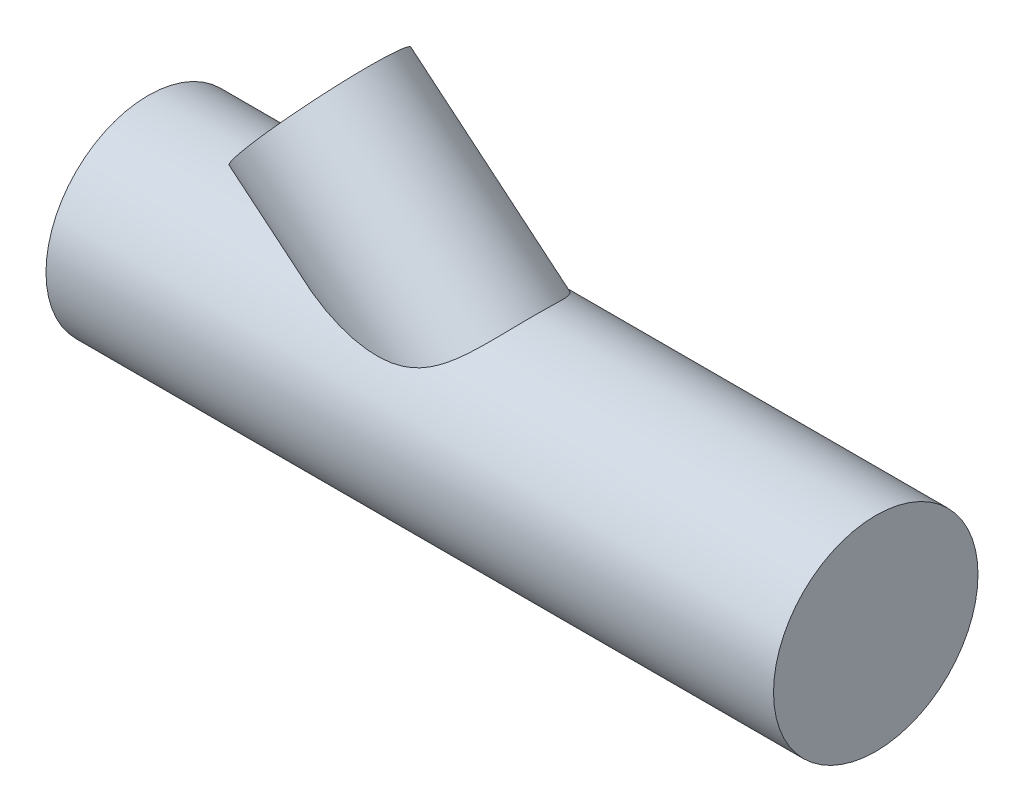
from build123d import *

# Parameters (mm, degrees)
SKETCH_2_W = 142.316235182
SKETCH_2_H = 20


with BuildPart() as part:
    # 草图2 → 旋转-薄壁1 (revolve)
    with BuildSketch(Plane(origin=(34.854392764, -17.173042845, 0), x_dir=(1, 0, 0), z_dir=(0, 0, 1)), mode=Mode.PRIVATE) as revolve_1_sk:
        with Locations((-33.020284957, 38.403293252)):
            Rectangle(SKETCH_2_W, SKETCH_2_H)
    revolve(revolve_1_sk.sketch.rotate(Axis((-69.324009784, 11.230250407, 0), (1, 0, 0)), 90), axis=Axis((-69.324009784, 11.230250407, 0), (1, 0, 0)))

    # 草图3 → 旋转-薄壁2 (revolve)
    with BuildSketch(Plane(origin=(10.637092158, -26.300007698, 0), x_dir=(1, 0, 0), z_dir=(0, 0, 1)), mode=Mode.PRIVATE) as revolve_2_sk:
        Polygon((-46.384190984, 72.518958842), (1.156884509, 32.969118261), (10.749952786, 44.500511977), (-36.791122707, 84.050352558), align=None)
    revolve(revolve_2_sk.sketch.rotate(Axis((-35.747098826, 46.218951144, 0), (0.7687595810801363, -0.639537885115099, 0)), 180), axis=Axis((-35.747098826, 46.218951144, 0), (0.7687595810801363, -0.639537885115099, 0)))


solid = part.part
